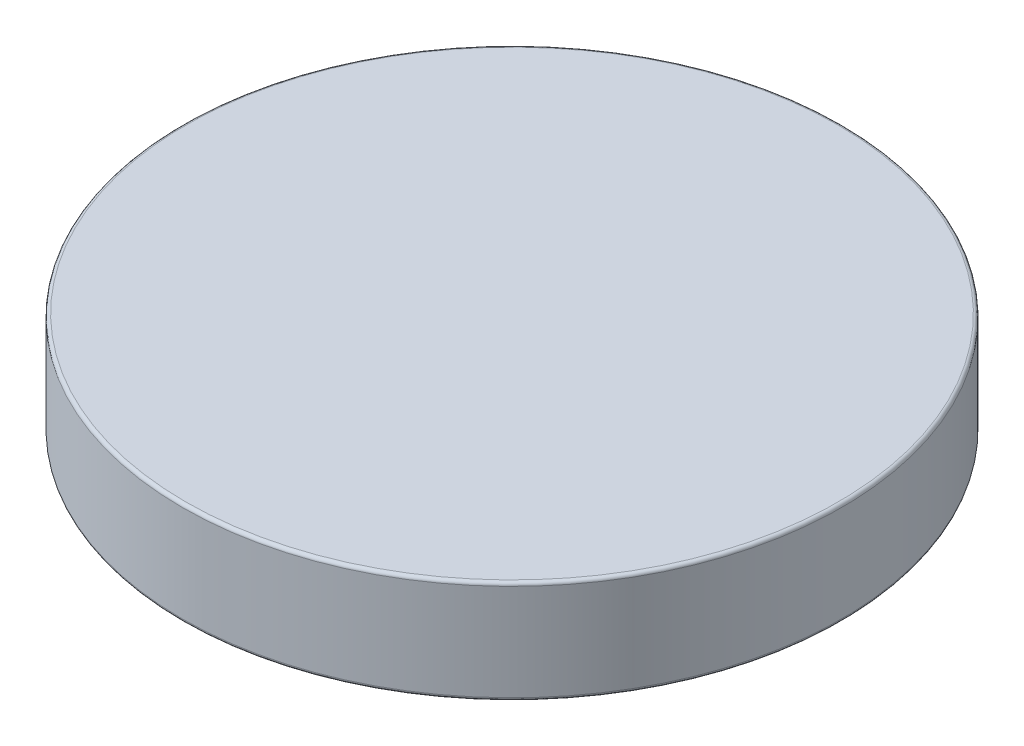
from build123d import *

# Parameters (mm, degrees)
SKETCH1_R     = 2.54
MAGNET_DEPTH  = 0.79375
EDGE_FILLET_R = 0.0254


with BuildPart() as part:
    # Sketch1 → magnet (new body)
    with BuildSketch(Plane(origin=(0, 0, 0), x_dir=(1, 0, 0), z_dir=(0, 1, 0))):
        with Locations(Location((0, 0, 0), (0, 0, 270))):
            Circle(SKETCH1_R)
    extrude(amount=MAGNET_DEPTH)

    # edge_fillet
    edge_fillet_edges = [part.edges().sort_by_distance(p)[0] for p in [
        (0, 0, -2.54),
        (0, 0.79375, -2.54),
    ]]
    fillet(edge_fillet_edges, radius=EDGE_FILLET_R)


solid = part.part
